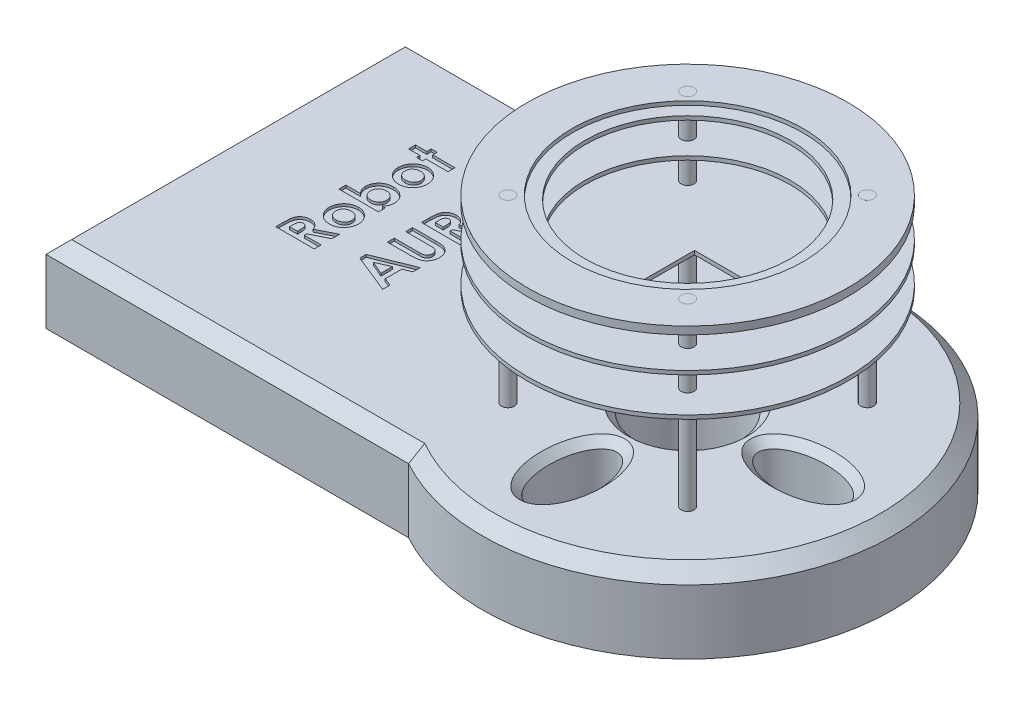
from build123d import *

# Parameters (mm, degrees)
SKETCH1_R             = 20
SKETCH1_R_2           = 2.5
SKETCH1_RX            = 17.5
SKETCH1_RY            = 9
BOSS_EXTRUDE1_DEPTH   = 30
SKETCH1_2_R           = 2.5
BOSS_EXTRUDE2_DEPTH   = 100
BOSS_EXTRUDE2_2_DEPTH = 100
BOSS_EXTRUDE2_3_DEPTH = 100
BOSS_EXTRUDE2_4_DEPTH = 100
SKETCH2_R             = 62.5
SKETCH2_R_2           = 2.5
SKETCH2_R_3           = 40
BOSS_EXTRUDE3_DEPTH   = 3
SKETCH2_3_R           = 45
CUT_EXTRUDE1_DEPTH    = 1.5
SKETCH9_R             = 62.5
SKETCH9_R_2           = 2.5
SKETCH9_R_3           = 40
BOSS_EXTRUDE4_DEPTH   = 1.5
SKETCH10_R            = 62.5
SKETCH10_R_2          = 2.5
SKETCH10_W            = 20
SKETCH10_H            = 40
BOSS_EXTRUDE5_DEPTH   = 1.5
CHAMFER1_SIZE         = 5
CUT_EXTRUDE2_DEPTH    = 1
CHAMFER2_SIZE         = 3


with BuildPart() as part:
    # Sketch1 → Boss-Extrude1 (new body)
    with BuildSketch(Plane(origin=(0, 0, 0), x_dir=(1, 0, 0), z_dir=(0, 1, 0))):
        with BuildLine():
            Line((-38.729833462, 70), (-180, 70))
            Line((-180, 70), (-180, -70))
            Line((-180, -70), (-38.729833462, -70))
            ThreePointArc((-38.729833462, -70), (80, 0), (-38.729833462, 70))
        make_face()
        Circle(SKETCH1_R, mode=Mode.SUBTRACT)
        with Locations((-35, -35)):
            Circle(SKETCH1_R_2, mode=Mode.SUBTRACT)
        with Locations((-35, 35)):
            Circle(SKETCH1_R_2, mode=Mode.SUBTRACT)
        with Locations((35, 35)):
            Circle(SKETCH1_R_2, mode=Mode.SUBTRACT)
        with Locations((35, -35)):
            Circle(SKETCH1_R_2, mode=Mode.SUBTRACT)
        with Locations(Location((0, -45), (0, 0, -90))):
            Ellipse(SKETCH1_RX, SKETCH1_RY, mode=Mode.SUBTRACT)
        with Locations(Location((-45, 0), (0, 0, 0))):
            Ellipse(SKETCH1_RX, SKETCH1_RY, mode=Mode.SUBTRACT)
        with Locations(Location((0, 45), (0, 0, 90))):
            Ellipse(SKETCH1_RX, SKETCH1_RY, mode=Mode.SUBTRACT)
        with Locations(Location((45, 0), (0, 0, 0))):
            Ellipse(SKETCH1_RX, SKETCH1_RY, mode=Mode.SUBTRACT)
    extrude(amount=BOSS_EXTRUDE1_DEPTH)

    # Chamfer1
    chamfer1_edges = [part.edges().sort_by_distance(p)[0] for p in [
        (-180, 30, 0),
        (-109.364916731, 30, -70),
        (80, 30, 0),
        (-109.364916731, 30, 70),
    ]]
    chamfer(chamfer1_edges, length=CHAMFER1_SIZE)

    # Sketch11 → Cut-Extrude2 (cut)
    # profile 1 of 9: a face of its own
    with BuildSketch(Plane(origin=(0, 30, 0), x_dir=(1, 0, 0), z_dir=(0, 1, 0))):
        with BuildLine():
            Line((-139.576846623, -20.903852916), (-139.576846623, -17.766833685))
            add(Edge.make_bspline(
                [(-139.576846623, -17.766833685), (-139.576121477, -17.559476134), (-139.574726817, -17.160669153), (-139.552249969, -16.585635846), (-139.521653621, -16.057301781), (-139.472666498, -15.575403899), (-139.414914211, -15.138771702), (-139.339633205, -14.748804554), (-139.255421444, -14.404274215), (-139.150064367, -14.102695454), (-139.031411458, -13.83044564), (-138.894674877, -13.576961385), (-138.742803562, -13.334758089), (-138.565965201, -13.111641074), (-138.379938277, -12.894565988), (-138.17217691, -12.694219246), (-137.946290066, -12.507158622), (-137.702322876, -12.336761123), (-137.445431426, -12.180065147), (-137.174686565, -12.045275134), (-136.892290596, -11.930353003), (-136.599635694, -11.833789819), (-136.29380271, -11.761792051), (-135.978279289, -11.712492042), (-135.651398388, -11.676218804), (-135.42931596, -11.674142719), (-135.316029315, -11.673083685)],
                knots=[0, 0, 0, 0, 1.748890285, 3.363608654, 4.853419723, 6.211897754, 7.448506646, 8.566916444, 9.560702549, 10.437053547, 11.257979428, 12.063058964, 12.86458444, 13.665575447, 14.461919362, 15.274455744, 16.096554533, 16.933325211, 17.78237398, 18.632472903, 19.481227396, 20.352186419, 21.229229428, 22.127857616, 23.044999956, 24, 24, 24, 24], degree=3))
            add(Edge.make_bspline(
                [(-135.316029315, -11.673083685), (-135.197787985, -11.675853357), (-134.965938288, -11.681284177), (-134.625325236, -11.710295007), (-134.298660375, -11.76422955), (-133.988040047, -11.843259189), (-133.690282959, -11.937853025), (-133.410036335, -12.060361161), (-133.142342646, -12.199671768), (-132.891613238, -12.364939333), (-132.652459855, -12.546426636), (-132.433568461, -12.757202629), (-132.224562717, -12.985357626), (-132.032560003, -13.237834529), (-131.858755568, -13.513877448), (-131.696089728, -13.808295672), (-131.547451703, -14.125158056), (-131.464313251, -14.347728734), (-131.421798546, -14.461545224)],
                knots=[0, 0, 0, 0, 1.099808295, 2.156523617, 3.176426857, 4.17500812, 5.135317955, 6.078349783, 7.015890908, 7.9382699, 8.868004242, 9.803692517, 10.759882289, 11.743580734, 12.748787378, 13.791075452, 14.870417076, 16, 16, 16, 16], degree=3))
            Line((-131.421798546, -14.461545224), (-124.576846623, -11.000006762))
            Line((-124.576846623, -11.000006762), (-124.576846623, -13.992795224))
            Line((-124.576846623, -13.992795224), (-131.115308161, -17.298083685))
            Line((-131.115308161, -17.298083685), (-131.115308161, -18.211545224))
            Line((-131.115308161, -18.211545224), (-124.576846623, -18.211545224))
            Line((-124.576846623, -18.211545224), (-124.576846623, -20.903852916))
            Line((-124.576846623, -20.903852916), (-139.576846623, -20.903852916))
        make_face()
        with BuildLine():
            Line((-133.807615854, -18.211545224), (-133.807615854, -17.162867339))
            add(Edge.make_bspline(
                [(-133.807615854, -17.162867339), (-133.809059836, -17.034657751), (-133.811824753, -16.789163937), (-133.824649581, -16.43611159), (-133.855551079, -16.115455861), (-133.894593967, -15.825819745), (-133.93967462, -15.56574582), (-134.004277932, -15.337553853), (-134.073502016, -15.137727755), (-134.159529597, -14.968635473), (-134.257361614, -14.824166912), (-134.368501217, -14.699427556), (-134.497131157, -14.596250224), (-134.639755825, -14.511330016), (-134.797636703, -14.445271327), (-134.969040615, -14.397053545), (-135.155920073, -14.370106935), (-135.284892346, -14.367006636), (-135.352087008, -14.365391378)],
                knots=[0, 0, 0, 0, 1.688639943, 3.233382647, 4.650958383, 5.928841754, 7.082724185, 8.122798841, 9.049171256, 9.863274652, 10.613301712, 11.341792392, 12.054588806, 12.776240173, 13.521029143, 14.301969904, 15.115324896, 16, 16, 16, 16], degree=3))
            add(Edge.make_bspline(
                [(-135.352087008, -14.365391378), (-135.431627634, -14.368295847), (-135.586898455, -14.373965646), (-135.811064027, -14.435268714), (-136.020041713, -14.527774666), (-136.210995176, -14.65870803), (-136.377896049, -14.822153672), (-136.52533653, -15.00977421), (-136.640624073, -15.226453923), (-136.721581657, -15.425110798), (-136.767025467, -15.607557142), (-136.801150078, -15.771646405), (-136.826507183, -15.961495815), (-136.847033322, -16.178067388), (-136.865355591, -16.419448136), (-136.87701505, -16.688002833), (-136.882150557, -16.982558841), (-136.883719883, -17.187906071), (-136.884538931, -17.295078878)],
                knots=[0, 0, 0, 0, 1.020140795, 1.991411262, 2.965409065, 3.947543434, 4.949233831, 5.95883764, 7.001880521, 8.094604842, 8.706727239, 9.41631554, 10.248493651, 11.167128553, 12.212949395, 13.360078347, 14.622198054, 16, 16, 16, 16], degree=3))
            Line((-136.884538931, -17.295078878), (-136.884538931, -18.211545224))
            Line((-136.884538931, -18.211545224), (-133.807615854, -18.211545224))
        make_face(mode=Mode.SUBTRACT)
    # profile 2 of 9: a face of its own
    with BuildSketch(Plane(origin=(0, 30, 0), x_dir=(1, 0, 0), z_dir=(0, 1, 0))):
        with BuildLine():
            add(Edge.make_bspline(
                [(-135.730692777, -3.950727916), (-135.72845782, -3.82343348), (-135.724031594, -3.571332816), (-135.686247395, -3.19598918), (-135.626956969, -2.826477674), (-135.54185972, -2.46360766), (-135.437462022, -2.105312936), (-135.303327806, -1.755400706), (-135.151582662, -1.407429891), (-134.970265167, -1.071100889), (-134.773865845, -0.743669658), (-134.55684813, -0.433556963), (-134.322042041, -0.14137849), (-134.070203455, 0.131897926), (-133.801132185, 0.384685777), (-133.517715206, 0.621714482), (-133.213906944, 0.83634304), (-132.896274522, 1.034767404), (-132.567034797, 1.21149944), (-132.228375626, 1.364938746), (-131.885006482, 1.49811492), (-131.53273764, 1.602387898), (-131.176216151, 1.688716672), (-130.811072597, 1.743196185), (-130.441058058, 1.781927364), (-130.191933817, 1.786270355), (-130.066630277, 1.788454776)],
                knots=[0, 0, 0, 0, 1.022405107, 2.024825386, 3.027536274, 4.026883869, 5.01725043, 6.023055913, 7.035310063, 8.064783298, 9.090097283, 10.101295518, 11.102843468, 12.099336335, 13.084064592, 14.066917206, 15.06496821, 16.069711, 17.07409931, 18.064335113, 19.055093846, 20.030042637, 21.013718342, 21.999268124, 22.993679677, 24, 24, 24, 24], degree=3))
            add(Edge.make_bspline(
                [(-130.066630277, 1.788454776), (-129.940348729, 1.786146647), (-129.689272384, 1.781557564), (-129.315763751, 1.744630741), (-128.948954372, 1.683315227), (-128.587313336, 1.60491104), (-128.234729717, 1.492750954), (-127.885265323, 1.366979494), (-127.545471761, 1.206764195), (-127.21003928, 1.03196133), (-126.887084991, 0.835192652), (-126.581999905, 0.616808313), (-126.294224466, 0.382761258), (-126.022199681, 0.133849263), (-125.772141236, -0.135309163), (-125.54051385, -0.422328748), (-125.3241922, -0.724353125), (-125.128330513, -1.043654916), (-124.956229696, -1.376117144), (-124.801067899, -1.716140243), (-124.67188434, -2.065710502), (-124.56653878, -2.424104992), (-124.48497233, -2.791540927), (-124.429563275, -3.167207141), (-124.391026915, -3.550294577), (-124.386715515, -3.808403808), (-124.384538931, -3.938708685)],
                knots=[0, 0, 0, 0, 1.012065869, 2.012216375, 3.004733514, 3.992205109, 4.97496602, 5.968164778, 6.966799732, 7.983091762, 8.999225232, 9.995016355, 10.988052865, 11.970944933, 12.947950481, 13.92969433, 14.925485454, 15.92373309, 16.929186062, 17.924491632, 18.917690389, 19.913513875, 20.91665649, 21.931711093, 22.955836906, 24, 24, 24, 24], degree=3))
            add(Edge.make_bspline(
                [(-124.384538931, -3.938708685), (-124.390138781, -4.129237202), (-124.401176172, -4.504771808), (-124.476574557, -5.057910859), (-124.606926842, -5.589041777), (-124.786796732, -6.100635616), (-125.024364692, -6.587975406), (-125.306143643, -7.05766031), (-125.647778832, -7.500209307), (-126.030237374, -7.920032252), (-126.451244415, -8.3017518), (-126.89778321, -8.638587163), (-127.368434766, -8.921711135), (-127.861308539, -9.155350949), (-128.377238429, -9.33548252), (-128.914457071, -9.465617232), (-129.474535288, -9.541209897), (-129.855066324, -9.55214007), (-130.048601431, -9.55769907)],
                knots=[0, 0, 0, 0, 1.030098614, 2.030340051, 3.011502429, 3.982690393, 4.9563966, 5.938096863, 6.938909888, 7.973851373, 9.005145063, 10.007012469, 10.993347251, 11.969610266, 12.95101174, 13.942698978, 14.953672802, 16, 16, 16, 16], degree=3))
            add(Edge.make_bspline(
                [(-130.048601431, -9.55769907), (-130.255254706, -9.551946474), (-130.661427582, -9.540639861), (-131.256480102, -9.450860383), (-131.826214688, -9.307492242), (-132.369037614, -9.101696306), (-132.885950042, -8.838810098), (-133.375861747, -8.517885616), (-133.838883699, -8.137336831), (-134.11893525, -7.845912664), (-134.261341815, -7.697723108)],
                knots=[0, 0, 0, 0, 1.043912699, 2.05178951, 3.033892, 4.007821512, 4.978932272, 5.95884105, 6.962068106, 8, 8, 8, 8], degree=3))
            add(Edge.make_bspline(
                [(-134.261341815, -7.697723108), (-134.37938084, -7.561744378), (-134.612247401, -7.293486493), (-134.907600456, -6.857655721), (-135.162695388, -6.411414189), (-135.372430868, -5.949413501), (-135.530568036, -5.47036572), (-135.645677745, -4.976725691), (-135.716381502, -4.468596062), (-135.725898109, -4.124227879), (-135.730692777, -3.950727916)],
                knots=[0, 0, 0, 0, 1.048115528, 2.067714963, 3.060638214, 4.039924844, 5.017819947, 5.994373833, 6.98952318, 8, 8, 8, 8], degree=3))
        make_face()
        with BuildLine():
            add(Edge.make_bspline(
                [(-133.230692777, -3.890631762), (-133.227353659, -3.994906367), (-133.22078057, -4.200172048), (-133.182419527, -4.501474131), (-133.113935075, -4.789124845), (-133.011297163, -5.061076982), (-132.890544363, -5.324221536), (-132.735372882, -5.571141249), (-132.553133835, -5.803696351), (-132.347480949, -6.022798078), (-132.117550366, -6.218529208), (-131.871481145, -6.392110729), (-131.61072681, -6.540483076), (-131.331248338, -6.656497162), (-131.039178359, -6.751274192), (-130.729848756, -6.815646517), (-130.406479246, -6.86038037), (-130.184978117, -6.863705154), (-130.072639892, -6.865391378)],
                knots=[0, 0, 0, 0, 1.030405752, 2.028364813, 2.995676022, 3.944329772, 4.896127072, 5.85177522, 6.817820016, 7.811895093, 8.815529982, 9.795715103, 10.783861249, 11.772750455, 12.780524062, 13.813161006, 14.890905832, 16, 16, 16, 16], degree=3))
            add(Edge.make_bspline(
                [(-130.072639892, -6.865391378), (-129.956338721, -6.863420755), (-129.729050417, -6.859569552), (-129.397187737, -6.819656333), (-129.082219079, -6.753909091), (-128.784784814, -6.660259434), (-128.50300838, -6.543663731), (-128.239575794, -6.397674857), (-127.993158357, -6.226236676), (-127.764720231, -6.030848231), (-127.558459463, -5.815457124), (-127.376042645, -5.584154861), (-127.227108106, -5.334969066), (-127.097673405, -5.076339058), (-127.003222895, -4.801035265), (-126.932319823, -4.513686875), (-126.894444163, -4.211145768), (-126.887886076, -4.004907145), (-126.884538931, -3.899646185)],
                knots=[0, 0, 0, 0, 1.141979911, 2.23178043, 3.277659926, 4.298338318, 5.290546728, 6.26815979, 7.25071132, 8.234641181, 9.215812446, 10.176243271, 11.121178574, 12.06282999, 13.01190517, 13.973595049, 14.965754676, 16, 16, 16, 16], degree=3))
            add(Edge.make_bspline(
                [(-126.884538931, -3.899646185), (-126.887500821, -3.794328549), (-126.893307845, -3.587844843), (-126.936793284, -3.28500529), (-127.005230803, -2.995981852), (-127.101815755, -2.719503723), (-127.228500064, -2.45780657), (-127.383666471, -2.20988741), (-127.563874513, -1.973569776), (-127.774888622, -1.756630587), (-128.003785313, -1.555865402), (-128.251956604, -1.379618625), (-128.516770875, -1.233478209), (-128.796742745, -1.110523023), (-129.093462154, -1.018904689), (-129.40636018, -0.953396898), (-129.733818137, -0.908789208), (-129.958304488, -0.905518668), (-130.072639892, -0.903852916)],
                knots=[0, 0, 0, 0, 1.03148129, 2.022302122, 2.990961611, 3.937500375, 4.885462201, 5.833017655, 6.798640665, 7.791063629, 8.792613068, 9.77817235, 10.766512052, 11.750898281, 12.768848897, 13.802335193, 14.880685208, 16, 16, 16, 16], degree=3))
            add(Edge.make_bspline(
                [(-130.072639892, -0.903852916), (-130.186939418, -0.905849591), (-130.411232165, -0.909767714), (-130.739075279, -0.949670223), (-131.050235507, -1.014820385), (-131.34338422, -1.109501313), (-131.621865779, -1.226363523), (-131.884254742, -1.370696902), (-132.129258776, -1.543975884), (-132.355663016, -1.740418429), (-132.559867591, -1.95768287), (-132.7419685, -2.188156002), (-132.892579942, -2.437108038), (-133.016737535, -2.699868489), (-133.112259079, -2.977136433), (-133.183164104, -3.268600593), (-133.220608514, -3.575154216), (-133.227296225, -3.78437354), (-133.230692777, -3.890631762)],
                knots=[0, 0, 0, 0, 1.123894411, 2.205445421, 3.243160173, 4.246488011, 5.231014757, 6.210004299, 7.185865357, 8.177612767, 9.153374344, 10.115157457, 11.061423229, 12.009021698, 12.96873347, 13.94135618, 14.954456845, 16, 16, 16, 16], degree=3))
        make_face(mode=Mode.SUBTRACT)
    # profile 3 of 9: a face of its own
    with BuildSketch(Plane(origin=(0, 30, 0), x_dir=(1, 0, 0), z_dir=(0, 1, 0))):
        with BuildLine():
            Line((-139.961462008, 6.788454776), (-134.261341815, 6.788454776))
            add(Edge.make_bspline(
                [(-134.261341815, 6.788454776), (-134.379056614, 6.913472683), (-134.610137033, 7.15888949), (-134.908909323, 7.55959582), (-135.161223677, 7.974643152), (-135.372347303, 8.403828664), (-135.530387299, 8.850160716), (-135.645707553, 9.310813272), (-135.716385295, 9.786073796), (-135.725898669, 10.108530258), (-135.730692777, 10.271026892)],
                knots=[0, 0, 0, 0, 1.061273251, 2.083335899, 3.084058773, 4.061996401, 5.035766215, 6.006279825, 6.995297484, 8, 8, 8, 8], degree=3))
            add(Edge.make_bspline(
                [(-135.730692777, 10.271026892), (-135.726470547, 10.447589038), (-135.718154125, 10.795359176), (-135.640285876, 11.3069756), (-135.514935976, 11.797504683), (-135.338240128, 12.267276363), (-135.115369599, 12.718912628), (-134.837817997, 13.148254006), (-134.509385938, 13.555780657), (-134.139436987, 13.942240338), (-133.728087906, 14.293949578), (-133.284416374, 14.602602678), (-132.811617466, 14.862048983), (-132.312332091, 15.077436004), (-131.781173706, 15.237381584), (-131.225167722, 15.359701009), (-130.639246296, 15.428030454), (-130.240074154, 15.437482447), (-130.0365822, 15.44230093)],
                knots=[0, 0, 0, 0, 0.985918914, 1.941940352, 2.883887689, 3.810010177, 4.7409891, 5.692528817, 6.659995536, 7.661310393, 8.677387444, 9.67863975, 10.675488032, 11.68583178, 12.710700752, 13.769889703, 14.863123313, 16, 16, 16, 16], degree=3))
            add(Edge.make_bspline(
                [(-130.0365822, 15.44230093), (-129.840057443, 15.437737801), (-129.452663817, 15.428742866), (-128.883947517, 15.356041191), (-128.340626259, 15.232889269), (-127.82267239, 15.059887582), (-127.328628209, 14.841184633), (-126.86022809, 14.571136719), (-126.415384713, 14.254283237), (-126.002684808, 13.888918626), (-125.624353222, 13.494934303), (-125.293071946, 13.076442935), (-125.013240228, 12.64061845), (-124.781765231, 12.186327994), (-124.603714343, 11.71247097), (-124.479277967, 11.220503511), (-124.3960045, 10.711551727), (-124.388398852, 10.365513832), (-124.384538931, 10.189897084)],
                knots=[0, 0, 0, 0, 1.098654079, 2.165689428, 3.19963959, 4.209167422, 5.21456979, 6.215610373, 7.227372913, 8.263202325, 9.29315531, 10.278069275, 11.242856373, 12.184642801, 13.123994677, 14.066729874, 15.018851352, 16, 16, 16, 16], degree=3))
            add(Edge.make_bspline(
                [(-124.384538931, 10.189897084), (-124.388722348, 10.033463942), (-124.396959801, 9.725435711), (-124.458011044, 9.271373294), (-124.560804898, 8.835097748), (-124.701994358, 8.410803746), (-124.89624679, 7.998914496), (-125.133314019, 7.586811723), (-125.431022858, 7.181884513), (-125.65668544, 6.922087325), (-125.772760085, 6.788454776)],
                knots=[0, 0, 0, 0, 0.996354537, 1.961894523, 2.912155913, 3.848368634, 4.80469413, 5.808214142, 6.872605459, 8, 8, 8, 8], degree=3))
            Line((-125.772760085, 6.788454776), (-124.576846623, 6.788454776))
            Line((-124.576846623, 6.788454776), (-124.576846623, 4.096147084))
            Line((-124.576846623, 4.096147084), (-139.961462008, 4.096147084))
            Line((-139.961462008, 4.096147084), (-139.961462008, 6.788454776))
        make_face()
        with BuildLine():
            add(Edge.make_bspline(
                [(-133.230692777, 9.688094199), (-133.227333243, 9.578832069), (-133.220746731, 9.364618896), (-133.18299073, 9.050119231), (-133.111979309, 8.752108972), (-133.019854606, 8.466133438), (-132.895823227, 8.195534896), (-132.744604124, 7.939650233), (-132.568740339, 7.696179652), (-132.366674983, 7.470210435), (-132.140262139, 7.265900265), (-131.897910705, 7.084766939), (-131.636430871, 6.933391119), (-131.35841088, 6.80956999), (-131.063118638, 6.714105142), (-130.752498673, 6.644096879), (-130.425150579, 6.605919911), (-130.20193872, 6.599456216), (-130.087663931, 6.596147084)],
                knots=[0, 0, 0, 0, 1.06026186, 2.078689624, 3.066287985, 4.028070226, 4.989066778, 5.947308343, 6.907469395, 7.898408277, 8.88212702, 9.861613455, 10.828242951, 11.806957908, 12.808700115, 13.834195728, 14.891202165, 16, 16, 16, 16], degree=3))
            add(Edge.make_bspline(
                [(-130.087663931, 6.596147084), (-129.971390612, 6.599500991), (-129.743199219, 6.606083177), (-129.408851596, 6.643898963), (-129.092078277, 6.713571717), (-128.79218221, 6.810183289), (-128.50904802, 6.933391928), (-128.241906238, 7.083829242), (-127.99617825, 7.265972397), (-127.766462584, 7.46995789), (-127.561882536, 7.697082243), (-127.379663341, 7.938668122), (-127.224641488, 8.194658597), (-127.103218352, 8.467457071), (-127.001365774, 8.75078097), (-126.932806978, 9.050313548), (-126.894334789, 9.364567335), (-126.887847735, 9.578814653), (-126.884538931, 9.688094199)],
                knots=[0, 0, 0, 0, 1.117352564, 2.192852514, 3.227268818, 4.228520199, 5.215424661, 6.189435882, 7.167242953, 8.148642482, 9.136484888, 10.098826301, 11.052758603, 12.004504044, 12.963229885, 13.94132105, 14.949944837, 16, 16, 16, 16], degree=3))
            add(Edge.make_bspline(
                [(-126.884538931, 9.688094199), (-126.8876127, 9.79339873), (-126.893696999, 10.001841294), (-126.936190238, 10.306813335), (-127.005523151, 10.600023848), (-127.104718913, 10.878910974), (-127.232753519, 11.146626424), (-127.387582732, 11.401367452), (-127.574973154, 11.640443611), (-127.782477657, 11.867111924), (-128.012992037, 12.074835994), (-128.263096034, 12.253822365), (-128.525797457, 12.410848705), (-128.807940874, 12.531835681), (-129.102473441, 12.633113319), (-129.414893242, 12.702027023), (-129.742164502, 12.739997359), (-129.965373521, 12.746628175), (-130.078649508, 12.749993238)],
                knots=[0, 0, 0, 0, 1.021887628, 2.02275132, 2.982401445, 3.941706841, 4.889615714, 5.858283278, 6.828559237, 7.833004523, 8.838108184, 9.833717713, 10.814070705, 11.802105327, 12.807350012, 13.833298626, 14.900424194, 16, 16, 16, 16], degree=3))
            add(Edge.make_bspline(
                [(-130.078649508, 12.749993238), (-130.190907703, 12.746577446), (-130.412087778, 12.73984738), (-130.736615069, 12.702611028), (-131.044560294, 12.631196958), (-131.338673362, 12.539676975), (-131.61568822, 12.416050516), (-131.875271095, 12.262787966), (-132.124217116, 12.09017279), (-132.350546893, 11.884880656), (-132.55623665, 11.66122683), (-132.739007999, 11.423422246), (-132.889904711, 11.168624045), (-133.012916303, 10.899136903), (-133.113206809, 10.617196274), (-133.182551122, 10.319939985), (-133.220868297, 10.008613704), (-133.227373967, 9.796368987), (-133.230692777, 9.688094199)],
                knots=[0, 0, 0, 0, 1.094449365, 2.156371669, 3.177111318, 4.171221881, 5.154488592, 6.125613636, 7.106114198, 8.101661685, 9.096538865, 10.064961488, 11.019258098, 11.975848813, 12.948395745, 13.931080756, 14.94455893, 16, 16, 16, 16], degree=3))
        make_face(mode=Mode.SUBTRACT)
    # profile 4 of 9: a face of its own
    with BuildSketch(Plane(origin=(0, 30, 0), x_dir=(1, 0, 0), z_dir=(0, 1, 0))):
        with BuildLine():
            add(Edge.make_bspline(
                [(-135.730692777, 22.972349007), (-135.72845782, 23.099643443), (-135.724031594, 23.351744107), (-135.686247395, 23.727087743), (-135.626956969, 24.096599249), (-135.54185972, 24.459469263), (-135.437462022, 24.817763987), (-135.303327806, 25.167676217), (-135.151582662, 25.515647032), (-134.970265167, 25.851976035), (-134.773865845, 26.179407265), (-134.55684813, 26.48951996), (-134.322042041, 26.781698433), (-134.070203455, 27.054974849), (-133.801132185, 27.3077627), (-133.517715206, 27.544791405), (-133.213906944, 27.759419963), (-132.896274522, 27.957844327), (-132.567034797, 28.134576363), (-132.228375626, 28.288015669), (-131.885006482, 28.421191843), (-131.53273764, 28.525464821), (-131.176216151, 28.611793595), (-130.811072597, 28.666273108), (-130.441058058, 28.705004287), (-130.191933817, 28.709347279), (-130.066630277, 28.711531699)],
                knots=[0, 0, 0, 0, 1.022405107, 2.024825386, 3.027536274, 4.026883869, 5.01725043, 6.023055913, 7.035310063, 8.064783298, 9.090097283, 10.101295518, 11.102843468, 12.099336335, 13.084064592, 14.066917206, 15.06496821, 16.069711, 17.07409931, 18.064335113, 19.055093846, 20.030042637, 21.013718342, 21.999268124, 22.993679677, 24, 24, 24, 24], degree=3))
            add(Edge.make_bspline(
                [(-130.066630277, 28.711531699), (-129.940348729, 28.709223571), (-129.689272384, 28.704634487), (-129.315763751, 28.667707664), (-128.948954372, 28.60639215), (-128.587313336, 28.527987963), (-128.234729717, 28.415827877), (-127.885265323, 28.290056417), (-127.545471761, 28.129841118), (-127.21003928, 27.955038253), (-126.887084991, 27.758269575), (-126.581999905, 27.539885236), (-126.294224466, 27.305838181), (-126.022199681, 27.056926186), (-125.772141236, 26.78776776), (-125.54051385, 26.500748175), (-125.3241922, 26.198723798), (-125.128330513, 25.879422007), (-124.956229696, 25.546959779), (-124.801067899, 25.20693668), (-124.67188434, 24.857366421), (-124.56653878, 24.498971931), (-124.48497233, 24.131535996), (-124.429563275, 23.755869783), (-124.391026915, 23.372782346), (-124.386715515, 23.114673115), (-124.384538931, 22.984368238)],
                knots=[0, 0, 0, 0, 1.012065869, 2.012216375, 3.004733514, 3.992205109, 4.97496602, 5.968164778, 6.966799732, 7.983091762, 8.999225232, 9.995016355, 10.988052865, 11.970944933, 12.947950481, 13.92969433, 14.925485454, 15.92373309, 16.929186062, 17.924491632, 18.917690389, 19.913513875, 20.91665649, 21.931711093, 22.955836906, 24, 24, 24, 24], degree=3))
            add(Edge.make_bspline(
                [(-124.384538931, 22.984368238), (-124.390138781, 22.793839722), (-124.401176172, 22.418305115), (-124.476574557, 21.865166064), (-124.606926842, 21.334035146), (-124.786796732, 20.822441307), (-125.024364692, 20.335101517), (-125.306143643, 19.865416613), (-125.647778832, 19.422867616), (-126.030237374, 19.003044671), (-126.451244415, 18.621325123), (-126.89778321, 18.28448976), (-127.368434766, 18.001365788), (-127.861308539, 17.767725974), (-128.377238429, 17.587594403), (-128.914457071, 17.457459691), (-129.474535288, 17.381867026), (-129.855066324, 17.370936853), (-130.048601431, 17.365377853)],
                knots=[0, 0, 0, 0, 1.030098614, 2.030340051, 3.011502429, 3.982690393, 4.9563966, 5.938096863, 6.938909888, 7.973851373, 9.005145063, 10.007012469, 10.993347251, 11.969610266, 12.95101174, 13.942698978, 14.953672802, 16, 16, 16, 16], degree=3))
            add(Edge.make_bspline(
                [(-130.048601431, 17.365377853), (-130.255254706, 17.371130449), (-130.661427582, 17.382437062), (-131.256480102, 17.47221654), (-131.826214688, 17.615584681), (-132.369037614, 17.821380617), (-132.885950042, 18.084266825), (-133.375861747, 18.405191307), (-133.838883699, 18.785740092), (-134.11893525, 19.077164259), (-134.261341815, 19.225353815)],
                knots=[0, 0, 0, 0, 1.043912699, 2.05178951, 3.033892, 4.007821512, 4.978932272, 5.95884105, 6.962068106, 8, 8, 8, 8], degree=3))
            add(Edge.make_bspline(
                [(-134.261341815, 19.225353815), (-134.37938084, 19.361332545), (-134.612247401, 19.62959043), (-134.907600456, 20.065421203), (-135.162695388, 20.511662734), (-135.372430868, 20.973663422), (-135.530568036, 21.452711203), (-135.645677745, 21.946351232), (-135.716381502, 22.454480861), (-135.725898109, 22.798849044), (-135.730692777, 22.972349007)],
                knots=[0, 0, 0, 0, 1.048115528, 2.067714963, 3.060638214, 4.039924844, 5.017819947, 5.994373833, 6.98952318, 8, 8, 8, 8], degree=3))
        make_face()
        with BuildLine():
            add(Edge.make_bspline(
                [(-133.230692777, 23.032445161), (-133.227353659, 22.928170557), (-133.22078057, 22.722904876), (-133.182419527, 22.421602792), (-133.113935075, 22.133952079), (-133.011297163, 21.861999941), (-132.890544363, 21.598855387), (-132.735372882, 21.351935674), (-132.553133835, 21.119380572), (-132.347480949, 20.900278845), (-132.117550366, 20.704547715), (-131.871481145, 20.530966195), (-131.61072681, 20.382593847), (-131.331248338, 20.266579761), (-131.039178359, 20.171802731), (-130.729848756, 20.107430406), (-130.406479246, 20.062696553), (-130.184978117, 20.059371769), (-130.072639892, 20.057685546)],
                knots=[0, 0, 0, 0, 1.030405752, 2.028364813, 2.995676022, 3.944329772, 4.896127072, 5.85177522, 6.817820016, 7.811895093, 8.815529982, 9.795715103, 10.783861249, 11.772750455, 12.780524062, 13.813161006, 14.890905832, 16, 16, 16, 16], degree=3))
            add(Edge.make_bspline(
                [(-130.072639892, 20.057685546), (-129.956338721, 20.059656168), (-129.729050417, 20.063507371), (-129.397187737, 20.10342059), (-129.082219079, 20.169167832), (-128.784784814, 20.262817489), (-128.50300838, 20.379413192), (-128.239575794, 20.525402066), (-127.993158357, 20.696840247), (-127.764720231, 20.892228693), (-127.558459463, 21.107619799), (-127.376042645, 21.338922062), (-127.227108106, 21.588107858), (-127.097673405, 21.846737865), (-127.003222895, 22.122041658), (-126.932319823, 22.409390048), (-126.894444163, 22.711931155), (-126.887886076, 22.918169778), (-126.884538931, 23.023430738)],
                knots=[0, 0, 0, 0, 1.141979911, 2.23178043, 3.277659926, 4.298338318, 5.290546728, 6.26815979, 7.25071132, 8.234641181, 9.215812446, 10.176243271, 11.121178574, 12.06282999, 13.01190517, 13.973595049, 14.965754676, 16, 16, 16, 16], degree=3))
            add(Edge.make_bspline(
                [(-126.884538931, 23.023430738), (-126.887500821, 23.128748374), (-126.893307845, 23.33523208), (-126.936793284, 23.638071633), (-127.005230803, 23.927095071), (-127.101815755, 24.2035732), (-127.228500064, 24.465270353), (-127.383666471, 24.713189513), (-127.563874513, 24.949507147), (-127.774888622, 25.166446336), (-128.003785313, 25.367211521), (-128.251956604, 25.543458298), (-128.516770875, 25.689598714), (-128.796742745, 25.8125539), (-129.093462154, 25.904172234), (-129.40636018, 25.969680025), (-129.733818137, 26.014287715), (-129.958304488, 26.017558255), (-130.072639892, 26.019224007)],
                knots=[0, 0, 0, 0, 1.03148129, 2.022302122, 2.990961611, 3.937500375, 4.885462201, 5.833017655, 6.798640665, 7.791063629, 8.792613068, 9.77817235, 10.766512052, 11.750898281, 12.768848897, 13.802335193, 14.880685208, 16, 16, 16, 16], degree=3))
            add(Edge.make_bspline(
                [(-130.072639892, 26.019224007), (-130.186939418, 26.017227332), (-130.411232165, 26.013309209), (-130.739075279, 25.9734067), (-131.050235507, 25.908256538), (-131.34338422, 25.81357561), (-131.621865779, 25.6967134), (-131.884254742, 25.552380021), (-132.129258776, 25.379101039), (-132.355663016, 25.182658494), (-132.559867591, 24.965394053), (-132.7419685, 24.734920921), (-132.892579942, 24.485968885), (-133.016737535, 24.223208434), (-133.112259079, 23.94594049), (-133.183164104, 23.65447633), (-133.220608514, 23.347922707), (-133.227296225, 23.138703383), (-133.230692777, 23.032445161)],
                knots=[0, 0, 0, 0, 1.123894411, 2.205445421, 3.243160173, 4.246488011, 5.231014757, 6.210004299, 7.185865357, 8.177612767, 9.153374344, 10.115157457, 11.061423229, 12.009021698, 12.96873347, 13.94135618, 14.954456845, 16, 16, 16, 16], degree=3))
        make_face(mode=Mode.SUBTRACT)
    # profile 5 of 9: a face of its own
    with BuildSketch(Plane(origin=(0, 30, 0), x_dir=(1, 0, 0), z_dir=(0, 1, 0))):
        Polygon((-139.961462008, 31.211531699), (-139.961462008, 33.903839392), (-135.538385085, 33.903839392), (-135.538385085, 35.634608622), (-133.230692777, 35.634608622), (-133.230692777, 33.903839392), (-124.576846623, 33.903839392), (-124.576846623, 31.211531699), (-133.230692777, 31.211531699), (-133.230692777, 29.865377853), (-135.538385085, 29.865377853), (-135.538385085, 31.211531699), align=None)
    # profile 6 of 9: a face of its own
    with BuildSketch(Plane(origin=(0, 30, 0), x_dir=(1, 0, 0), z_dir=(0, 1, 0))):
        Polygon((-112.615308161, -15.131617339), (-112.615308161, -12.634622147), (-97.615308161, -6.576929839), (-97.615308161, -9.452530801), (-100.692231238, -10.618396185), (-100.692231238, -17.153852916), (-97.615308161, -18.319718301), (-97.615308161, -21.192314454), align=None)
        Polygon((-108.591870661, -13.884622147), (-103.384538931, -16.132218301), (-103.384538931, -11.637025993), align=None, mode=Mode.SUBTRACT)
    # profile 7 of 9: a face of its own
    with BuildSketch(Plane(origin=(0, 30, 0), x_dir=(1, 0, 0), z_dir=(0, 1, 0))):
        with BuildLine():
            Line((-112.615308161, -4.365391378), (-112.615308161, -1.673083685))
            Line((-112.615308161, -1.673083685), (-102.855692777, -1.673083685))
            add(Edge.make_bspline(
                [(-102.855692777, -1.673083685), (-102.754510016, -1.672931338), (-102.559076558, -1.67263708), (-102.27868231, -1.658561194), (-102.019985522, -1.645294849), (-101.78508314, -1.622722583), (-101.573245979, -1.587316394), (-101.383693571, -1.554259732), (-101.218115172, -1.508938439), (-101.029514632, -1.441069594), (-100.817642143, -1.335110993), (-100.594319845, -1.167051288), (-100.395544146, -0.966359537), (-100.228642797, -0.730014326), (-100.087475715, -0.46614311), (-99.994105513, -0.169545732), (-99.930774181, 0.150135862), (-99.925640169, 0.372858266), (-99.923000469, 0.487373046)],
                knots=[0, 0, 0, 0, 1.155195489, 2.231248153, 3.20507519, 4.113220553, 4.92363642, 5.657123012, 6.309133385, 6.880755525, 7.944644177, 8.999147208, 10.058600405, 11.156792429, 12.29246015, 13.460660758, 14.694375292, 16, 16, 16, 16], degree=3))
            add(Edge.make_bspline(
                [(-99.923000469, 0.487373046), (-99.926546682, 0.608898921), (-99.933461197, 0.845853803), (-100.001334645, 1.18667568), (-100.109412421, 1.502449074), (-100.263666947, 1.786488024), (-100.448568044, 2.038509723), (-100.65941319, 2.251841187), (-100.896623125, 2.420200282), (-101.115466829, 2.529934584), (-101.316894712, 2.591535234), (-101.496858348, 2.637744828), (-101.70823664, 2.671298784), (-101.949561453, 2.702712201), (-102.222591097, 2.720521703), (-102.525898349, 2.740803992), (-102.859667751, 2.748077392), (-103.09207282, 2.7493366), (-103.213264892, 2.749993238)],
                knots=[0, 0, 0, 0, 1.26131785, 2.459356261, 3.594833267, 4.716926138, 5.803419038, 6.833631221, 7.818372604, 8.814377287, 9.360705024, 10.004324776, 10.743421339, 11.582437492, 12.532246195, 13.585177397, 14.740744533, 16, 16, 16, 16], degree=3))
            Line((-103.213264892, 2.749993238), (-112.615308161, 2.749993238))
            Line((-112.615308161, 2.749993238), (-112.615308161, 5.44230093))
            Line((-112.615308161, 5.44230093), (-103.666990854, 5.44230093))
            add(Edge.make_bspline(
                [(-103.666990854, 5.44230093), (-103.485698373, 5.441927054), (-103.137090613, 5.441208127), (-102.636116729, 5.430167579), (-102.178557447, 5.406664248), (-101.764279065, 5.386924163), (-101.393839695, 5.348720332), (-101.065657428, 5.308920915), (-100.780895344, 5.258193095), (-100.456728104, 5.182713298), (-100.083462743, 5.052456566), (-99.653657579, 4.842470128), (-99.232876801, 4.575888834), (-98.825627563, 4.260869569), (-98.447670279, 3.904933763), (-98.114929011, 3.517520507), (-97.838065637, 3.100406979), (-97.614208909, 2.655519852), (-97.441840584, 2.178164475), (-97.320006259, 1.667214996), (-97.242479703, 1.119749476), (-97.234700508, 0.74205303), (-97.230692777, 0.547469199)],
                knots=[0, 0, 0, 0, 1.170930413, 2.251584989, 3.235934929, 4.130173708, 4.929654547, 5.640582214, 6.264911921, 6.796838084, 7.789064304, 8.810388137, 9.880124863, 11.000704429, 12.131026409, 13.227749078, 14.29171941, 15.356377855, 16.43689688, 17.561893293, 18.743922147, 20, 20, 20, 20], degree=3))
            add(Edge.make_bspline(
                [(-97.230692777, 0.547469199), (-97.232876955, 0.418168889), (-97.237186294, 0.16306203), (-97.274984967, -0.212149795), (-97.331144076, -0.574741569), (-97.411485642, -0.924905638), (-97.521157483, -1.261434564), (-97.650762858, -1.58650646), (-97.799056012, -1.901298869), (-97.979026695, -2.195974106), (-98.168065196, -2.477771329), (-98.374902524, -2.737236758), (-98.590366367, -2.978359802), (-98.819388545, -3.198339779), (-99.060337606, -3.397382298), (-99.31344941, -3.575332673), (-99.578782951, -3.731858661), (-99.861098723, -3.870919057), (-100.174753806, -3.989928773), (-100.530894186, -4.090308744), (-100.934174563, -4.177571269), (-101.387251664, -4.243629343), (-101.888062559, -4.301851312), (-102.438518463, -4.339576757), (-103.036838256, -4.359049623), (-103.451632385, -4.363224045), (-103.666990854, -4.365391378)],
                knots=[0, 0, 0, 0, 1.001237316, 1.975420686, 2.917953599, 3.841913885, 4.754568974, 5.656377887, 6.55158913, 7.445656762, 8.327865759, 9.178398172, 10.013362476, 10.830881591, 11.635451955, 12.431789376, 13.224756564, 14.019278107, 14.866442763, 15.819105778, 16.882716987, 18.059987251, 19.363897986, 20.787153213, 22.331910422, 24, 24, 24, 24], degree=3))
            Line((-103.666990854, -4.365391378), (-112.615308161, -4.365391378))
        make_face()
    # profile 8 of 9: a face of its own
    with BuildSketch(Plane(origin=(0, 30, 0), x_dir=(1, 0, 0), z_dir=(0, 1, 0))):
        with BuildLine():
            Line((-112.615308161, 8.903839392), (-112.615308161, 12.040858622))
            add(Edge.make_bspline(
                [(-112.615308161, 12.040858622), (-112.614583015, 12.248216174), (-112.613188355, 12.647023154), (-112.590711508, 13.222056462), (-112.56011516, 13.750390526), (-112.511128036, 14.232288409), (-112.45337575, 14.668920606), (-112.378094743, 15.058887754), (-112.293882983, 15.403418093), (-112.188525905, 15.704996853), (-112.069872997, 15.977246667), (-111.933136415, 16.230730922), (-111.781265101, 16.472934219), (-111.60442674, 16.696051234), (-111.418399816, 16.91312632), (-111.210638448, 17.113473062), (-110.984751605, 17.300533686), (-110.740784414, 17.470931185), (-110.483892965, 17.627627161), (-110.213148104, 17.762417173), (-109.930752134, 17.877339304), (-109.638097232, 17.973902489), (-109.332264249, 18.045900257), (-109.016740828, 18.095200265), (-108.689859926, 18.131473504), (-108.467777498, 18.133549589), (-108.354490854, 18.134608622)],
                knots=[0, 0, 0, 0, 1.748890285, 3.363608654, 4.853419723, 6.211897754, 7.448506646, 8.566916444, 9.560702549, 10.437053547, 11.257979428, 12.063058964, 12.86458444, 13.665575447, 14.461919362, 15.274455744, 16.096554533, 16.933325211, 17.78237398, 18.632472903, 19.481227396, 20.352186419, 21.229229428, 22.127857616, 23.044999956, 24, 24, 24, 24], degree=3))
            add(Edge.make_bspline(
                [(-108.354490854, 18.134608622), (-108.236249524, 18.131838951), (-108.004399827, 18.12640813), (-107.663786775, 18.097397301), (-107.337121913, 18.043462758), (-107.026501586, 17.964433118), (-106.728744497, 17.869839283), (-106.448497874, 17.747331147), (-106.180804185, 17.60802054), (-105.930074776, 17.442752975), (-105.690921394, 17.261265671), (-105.47203, 17.050489679), (-105.263024255, 16.822334682), (-105.071021541, 16.569857778), (-104.897217107, 16.29381486), (-104.734551267, 15.999396636), (-104.585913242, 15.682534252), (-104.50277479, 15.459963573), (-104.460260085, 15.346147084)],
                knots=[0, 0, 0, 0, 1.099808295, 2.156523617, 3.176426857, 4.17500812, 5.135317955, 6.078349783, 7.015890908, 7.9382699, 8.868004242, 9.803692517, 10.759882289, 11.743580734, 12.748787378, 13.791075452, 14.870417076, 16, 16, 16, 16], degree=3))
            Line((-104.460260085, 15.346147084), (-97.615308161, 18.807685546))
            Line((-97.615308161, 18.807685546), (-97.615308161, 15.814897084))
            Line((-97.615308161, 15.814897084), (-104.1537697, 12.509608622))
            Line((-104.1537697, 12.509608622), (-104.1537697, 11.596147084))
            Line((-104.1537697, 11.596147084), (-97.615308161, 11.596147084))
            Line((-97.615308161, 11.596147084), (-97.615308161, 8.903839392))
            Line((-97.615308161, 8.903839392), (-112.615308161, 8.903839392))
        make_face()
        with BuildLine():
            Line((-106.846077392, 11.596147084), (-106.846077392, 12.644824969))
            add(Edge.make_bspline(
                [(-106.846077392, 12.644824969), (-106.847521375, 12.773034557), (-106.850286291, 13.01852837), (-106.863111119, 13.371580717), (-106.894012617, 13.692236447), (-106.933055505, 13.981872563), (-106.978136158, 14.241946488), (-107.04273947, 14.470138454), (-107.111963555, 14.669964552), (-107.197991135, 14.839056835), (-107.295823152, 14.983525396), (-107.406962756, 15.108264752), (-107.535592695, 15.211442084), (-107.678217364, 15.296362292), (-107.836098241, 15.36242098), (-108.007502154, 15.410638763), (-108.194381612, 15.437585372), (-108.323353884, 15.440685672), (-108.390548546, 15.44230093)],
                knots=[0, 0, 0, 0, 1.688639943, 3.233382647, 4.650958383, 5.928841754, 7.082724185, 8.122798841, 9.049171256, 9.863274652, 10.613301712, 11.341792392, 12.054588806, 12.776240173, 13.521029143, 14.301969904, 15.115324896, 16, 16, 16, 16], degree=3))
            add(Edge.make_bspline(
                [(-108.390548546, 15.44230093), (-108.470089172, 15.43939646), (-108.625359994, 15.433726661), (-108.849525565, 15.372423594), (-109.058503252, 15.279917642), (-109.249456714, 15.148984277), (-109.416357587, 14.985538636), (-109.563798068, 14.797918097), (-109.679085611, 14.581238385), (-109.760043195, 14.38258151), (-109.805487005, 14.200135166), (-109.839611617, 14.036045902), (-109.864968721, 13.846196493), (-109.88549486, 13.629624919), (-109.90381713, 13.388244172), (-109.915476589, 13.119689475), (-109.920612096, 12.825133466), (-109.922181422, 12.619786237), (-109.923000469, 12.51261343)],
                knots=[0, 0, 0, 0, 1.020140795, 1.991411262, 2.965409065, 3.947543434, 4.949233831, 5.95883764, 7.001880521, 8.094604842, 8.706727239, 9.41631554, 10.248493651, 11.167128553, 12.212949395, 13.360078347, 14.622198054, 16, 16, 16, 16], degree=3))
            Line((-109.923000469, 12.51261343), (-109.923000469, 11.596147084))
            Line((-109.923000469, 11.596147084), (-106.846077392, 11.596147084))
        make_face(mode=Mode.SUBTRACT)
    # profile 9 of 9: a face of its own
    with BuildSketch(Plane(origin=(0, 30, 0), x_dir=(1, 0, 0), z_dir=(0, 1, 0))):
        Polygon((-112.615308161, 25.63761343), (-112.615308161, 28.134608622), (-97.615308161, 34.19230093), (-97.615308161, 31.316699969), (-100.692231238, 30.150834584), (-100.692231238, 23.615377853), (-97.615308161, 22.449512469), (-97.615308161, 19.576916315), align=None)
        Polygon((-108.591870661, 26.884608622), (-103.384538931, 24.637012469), (-103.384538931, 29.132204776), align=None, mode=Mode.SUBTRACT)
    extrude(amount=-CUT_EXTRUDE2_DEPTH, mode=Mode.SUBTRACT)

    # Chamfer2
    chamfer2_edges = [part.edges().sort_by_distance(p)[0] for p in [
        (0.049788084, 30, -27.500267779),
        (-62.499732221, 30, 0.049788084),
        (-20, 30, 0),
        (27.500267779, 30, 0.049788084),
        (-0.049788084, 30, 27.500267779),
    ]]
    chamfer(chamfer2_edges, length=CHAMFER2_SIZE)


with BuildPart() as body_2:
    # Sketch1<2> → Boss-Extrude2 (new body)
    with BuildSketch(Plane(origin=(0, 0, 0), x_dir=(1, 0, 0), z_dir=(0, 1, 0))):
        with Locations((-35, -35)):
            Circle(SKETCH1_2_R)
    extrude(amount=BOSS_EXTRUDE2_DEPTH)


with BuildPart() as body_3:
    # Sketch1<2> → Boss-Extrude2 2 (new body)
    with BuildSketch(Plane(origin=(0, 0, 0), x_dir=(1, 0, 0), z_dir=(0, 1, 0))):
        with Locations((-35, 35)):
            Circle(SKETCH1_2_R)
    extrude(amount=BOSS_EXTRUDE2_2_DEPTH)


with BuildPart() as body_4:
    # Sketch1<2> → Boss-Extrude2 3 (new body)
    with BuildSketch(Plane(origin=(0, 0, 0), x_dir=(1, 0, 0), z_dir=(0, 1, 0))):
        with Locations((35, 35)):
            Circle(SKETCH1_2_R)
    extrude(amount=BOSS_EXTRUDE2_3_DEPTH)


with BuildPart() as body_5:
    # Sketch1<2> → Boss-Extrude2 4 (new body)
    with BuildSketch(Plane(origin=(0, 0, 0), x_dir=(1, 0, 0), z_dir=(0, 1, 0))):
        with Locations((35, -35)):
            Circle(SKETCH1_2_R)
    extrude(amount=BOSS_EXTRUDE2_4_DEPTH)


with BuildPart() as body_6:
    # Sketch2 → Boss-Extrude3 (new body)
    with BuildSketch(Plane(origin=(0, 100, 0), x_dir=(1, 0, 0), z_dir=(0, 1, 0))):
        Circle(SKETCH2_R)
        with Locations((-35, -35)):
            Circle(SKETCH2_R_2, mode=Mode.SUBTRACT)
        with Locations((35, -35)):
            Circle(SKETCH2_R_2, mode=Mode.SUBTRACT)
        with Locations((-35, 35)):
            Circle(SKETCH2_R_2, mode=Mode.SUBTRACT)
        with Locations((35, 35)):
            Circle(SKETCH2_R_2, mode=Mode.SUBTRACT)
        Circle(SKETCH2_R_3, mode=Mode.SUBTRACT)
    extrude(amount=-BOSS_EXTRUDE3_DEPTH)

    # Sketch2<3> → Cut-Extrude1 (cut)
    with BuildSketch(Plane(origin=(0, 100, 0), x_dir=(1, 0, 0), z_dir=(0, 1, 0))):
        Circle(SKETCH2_3_R)
    extrude(amount=-CUT_EXTRUDE1_DEPTH, mode=Mode.SUBTRACT)


with BuildPart() as body_7:
    # Sketch9 → Boss-Extrude4 (new body)
    with BuildSketch(Plane(origin=(0, 85, 0), x_dir=(1, 0, 0), z_dir=(0, 1, 0))):
        Circle(SKETCH9_R)
        with Locations((-35, -35)):
            Circle(SKETCH9_R_2, mode=Mode.SUBTRACT)
        with Locations((-35, 35)):
            Circle(SKETCH9_R_2, mode=Mode.SUBTRACT)
        with Locations((35, 35)):
            Circle(SKETCH9_R_2, mode=Mode.SUBTRACT)
        with Locations((35, -35)):
            Circle(SKETCH9_R_2, mode=Mode.SUBTRACT)
        Circle(SKETCH9_R_3, mode=Mode.SUBTRACT)
    extrude(amount=-BOSS_EXTRUDE4_DEPTH)


with BuildPart() as body_8:
    # Sketch10 → Boss-Extrude5 (new body)
    with BuildSketch(Plane(origin=(0, 70, 0), x_dir=(1, 0, 0), z_dir=(0, 1, 0))):
        Circle(SKETCH10_R)
        with Locations((-35, -35)):
            Circle(SKETCH10_R_2, mode=Mode.SUBTRACT)
        with Locations((-35, 35)):
            Circle(SKETCH10_R_2, mode=Mode.SUBTRACT)
        with Locations((35, 35)):
            Circle(SKETCH10_R_2, mode=Mode.SUBTRACT)
        with Locations((35, -35)):
            Circle(SKETCH10_R_2, mode=Mode.SUBTRACT)
        with Locations((0, -7.326895062)):
            Rectangle(SKETCH10_W, SKETCH10_H, mode=Mode.SUBTRACT)
    extrude(amount=-BOSS_EXTRUDE5_DEPTH)


solid = Compound([part.part, body_2.part, body_3.part, body_4.part, body_5.part, body_6.part, body_7.part, body_8.part])
